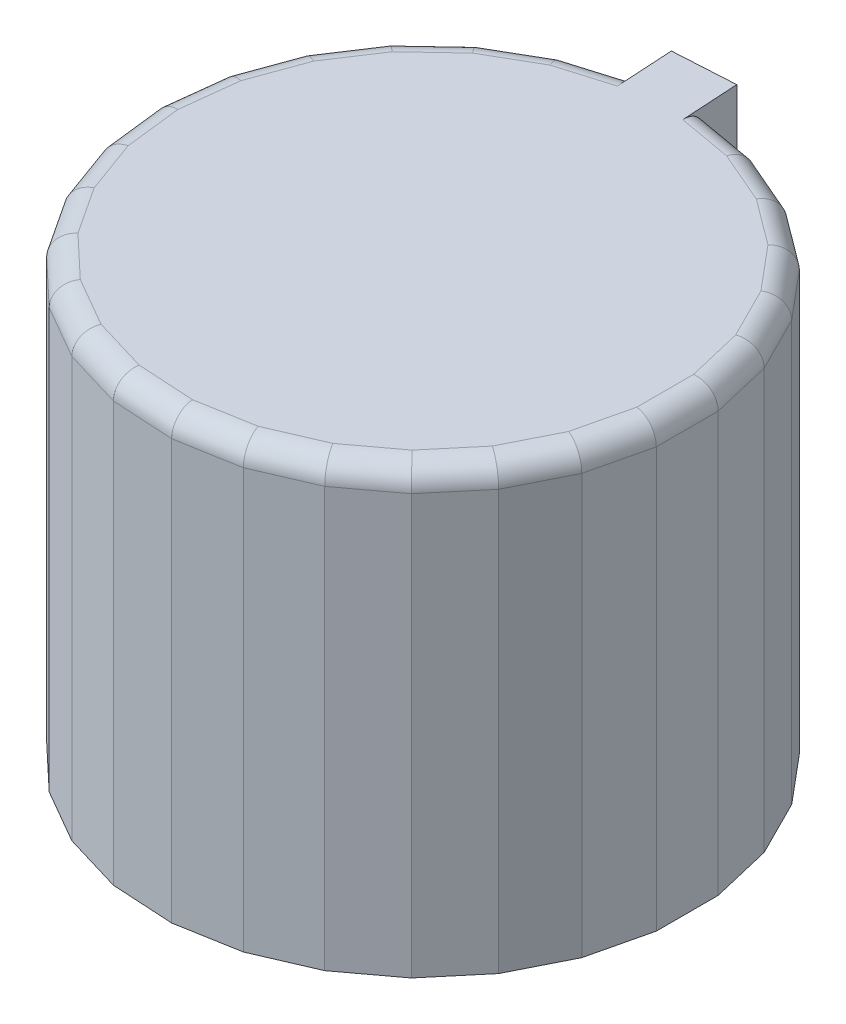
from build123d import *

# Parameters (mm, degrees)
BOSS_EXTRUDE1_DEPTH = 10
BOSS_EXTRUDE2_DEPTH = 10
FILLET2_R           = 0.5
CUT_EXTRUDE1_DEPTH  = 7


with BuildPart() as part:
    # Sketch1 → Boss-Extrude1 (new body)
    with BuildSketch(Plane(origin=(0, 0, 0), x_dir=(1, 0, 0), z_dir=(0, 1, 0))):
        Polygon((4.145480081, 4.393952182), (3.02042302, 5.231526131), (1.732534173, 5.787067152), (0.351243959, 6.030625884), (-1.048981906, 5.949072015), (-2.392656886, 5.546802133), (-3.607343114, 4.845502712), (-4.627556541, 3.882980986), (-5.398297196, 2.71112675), (-5.878014253, 1.39311497), (-6.04084604, 0), (-5.878014253, -1.39311497), (-5.398297196, -2.71112675), (-4.627556541, -3.882980986), (-3.607343114, -4.845502712), (-2.392656886, -5.546802133), (-1.048981906, -5.949072015), (0.351243959, -6.030625884), (1.732534173, -5.787067152), (3.02042302, -5.231526131), (4.145480081, -4.393952182), (5.047053237, -3.319499134), (5.676538447, -2.066091028), (6, -0.701299421), (6, 0.701299421), (5.676538447, 2.066091028), (5.047053237, 3.319499134), align=None)
    extrude(amount=BOSS_EXTRUDE1_DEPTH)

    # Sketch2 → Boss-Extrude2 (add)
    with BuildSketch(Plane(origin=(0, 0, 0), x_dir=(1, 0, 0), z_dir=(0, 1, 0))):
        Polygon((-1.094764488, 6.735128586), (0.305461378, 6.816682456), (0.351243959, 6.030625884), (-1.048981906, 5.949072015), align=None)
    extrude(amount=BOSS_EXTRUDE2_DEPTH)

    # Fillet2
    fillet2_edges = [part.edges().sort_by_distance(p)[0] for p in [
        (4.596266659, 10, 3.856725658),
        (5.361795842, 10, 2.692795081),
        (5.838269223, 10, 1.383695224),
        (5.361795842, 10, -2.692795081),
        (4.596266659, 10, -3.856725658),
        (3.58295155, 10, -4.812739157),
        (2.376478596, 10, -5.509296641),
        (1.041889066, 10, -5.908846518),
        (-1.720819396, 10, -5.747937074),
        (-3, 10, -5.196152423),
        (-4.117449827, 10, -4.364241849),
        (-5.012926868, 10, -3.297053868),
        (6, 10, 0),
        (-5.638155725, 10, -2.05212086),
        (-5.959430146, 10, -0.696557485),
        (-5.959430146, 10, 0.696557485),
        (-5.638155725, 10, 2.05212086),
        (-5.012926868, 10, 3.297053868),
        (-4.117449827, 10, 4.364241849),
        (-3, 10, 5.196152423),
        (-1.720819396, 10, 5.747937074),
        (-0.348868973, 10, 5.98984895),
        (1.041889066, 10, 5.908846518),
        (5.838269223, 10, -1.383695224),
        (2.376478596, 10, 5.509296641),
        (3.58295155, 10, 4.812739157),
    ]]
    fillet(fillet2_edges, radius=FILLET2_R)

    # Sketch4 → Cut-Extrude1 (cut)
    with BuildSketch(Plane(origin=(0, 0, 0), x_dir=(1, 0, 0), z_dir=(0, 1, 0))):
        with BuildLine():
            ThreePointArc((3.45, 0), (2.439518395, 2.439518395), (0, 3.45))
            Line((0, 3.45), (0, -1.55))
            Line((0, -1.55), (3.082207001, -1.55))
            ThreePointArc((3.082207001, -1.55), (3.356792677, -0.796519254), (3.45, 0))
        make_face()
        with BuildLine():
            Line((0, -1.55), (0, 3.45))
            ThreePointArc((0, 3.45), (-2.936835031, 1.810386699), (-3.082207001, -1.55))
            Line((-3.082207001, -1.55), (0, -1.55))
        make_face()
    extrude(amount=CUT_EXTRUDE1_DEPTH, mode=Mode.SUBTRACT)


solid = part.part
